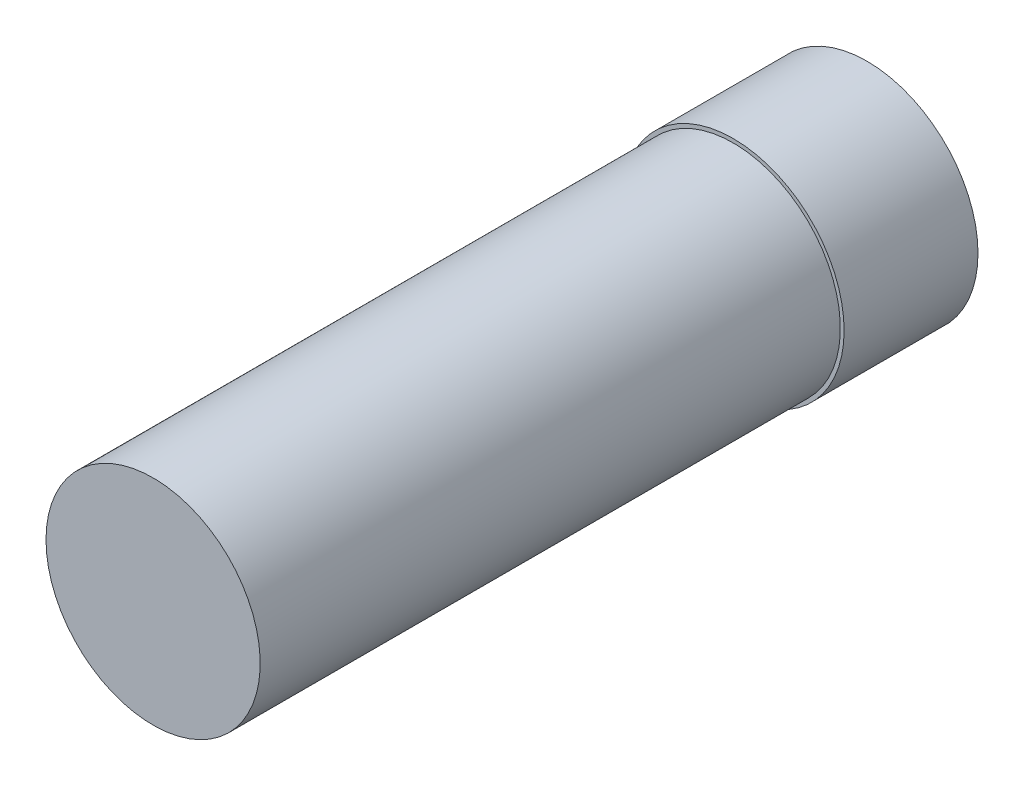
from build123d import *

# Parameters (mm, degrees)
SKETCH_1_R      = 2.485
EXTRUDE_1_DEPTH = 3
SKETCH_2_R      = 2.4
EXTRUDE_2_DEPTH = 13


with BuildPart() as part:
    # 스케치1 → 보스-돌출1 (new body)
    with BuildSketch(Plane.XY):
        Circle(SKETCH_1_R)
    extrude(amount=EXTRUDE_1_DEPTH)

    # 스케치2 → 보스-돌출2 (add)
    with BuildSketch(Plane.XY.offset(3)):
        with Locations(Location((0, 0, 0), (0, 0, 180))):
            Circle(SKETCH_2_R)
    extrude(amount=EXTRUDE_2_DEPTH)


solid = part.part
